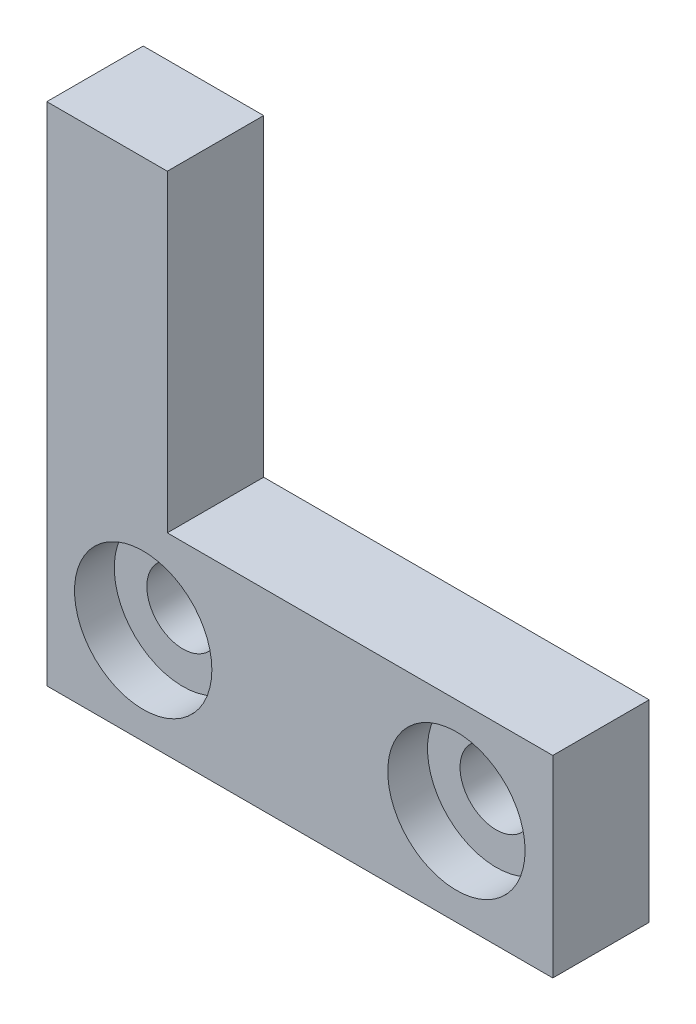
from build123d import *

# Parameters (mm, degrees)
CROQUIS1_W              = 13
CROQUIS1_H              = 8
CROQUIS1_R              = 1.5
SALIENTE_EXTRUIR1_DEPTH = 4
CROQUIS2_R              = 2.85
CORTAR_EXTRUIR1_DEPTH   = 1.65
CROQUIS3_W              = 3
CROQUIS3_H              = 4
CORTAR_EXTRUIR2_DEPTH   = 13


with BuildPart() as part:
    # Croquis1 → Saliente-Extruir1 (new body)
    # profile 1 of 2: a face of its own
    with BuildSketch(Plane.XY):
        with Locations((11.5, -79)):
            Rectangle(CROQUIS1_W, CROQUIS1_H)
        with Locations((14, -79)):
            Circle(CROQUIS1_R, mode=Mode.SUBTRACT)
    # profile 2 of 2: a face of its own
    with BuildSketch(Plane.XY):
        Polygon((5, -83), (5, -75), (5, -62), (-3, -62), (-3, -83), align=None)
        with Locations((1, -79)):
            Circle(CROQUIS1_R, mode=Mode.SUBTRACT)
    extrude(amount=SALIENTE_EXTRUIR1_DEPTH)

    # Croquis2 → Cortar-Extruir1 (cut)
    with BuildSketch(Plane.XY.offset(4)):
        with Locations((1, -79)):
            Circle(CROQUIS2_R)
        with Locations((14, -79)):
            Circle(CROQUIS2_R)
    extrude(amount=-CORTAR_EXTRUIR1_DEPTH, mode=Mode.SUBTRACT)

    # Croquis3 → Cortar-Extruir2 (cut)
    with BuildSketch(Plane(origin=(0, -62, 0), x_dir=(1, 0, 0), z_dir=(0, 1, 0))):
        with Locations((3.5, -2)):
            Rectangle(CROQUIS3_W, CROQUIS3_H)
    extrude(amount=-CORTAR_EXTRUIR2_DEPTH, mode=Mode.SUBTRACT)


solid = part.part
